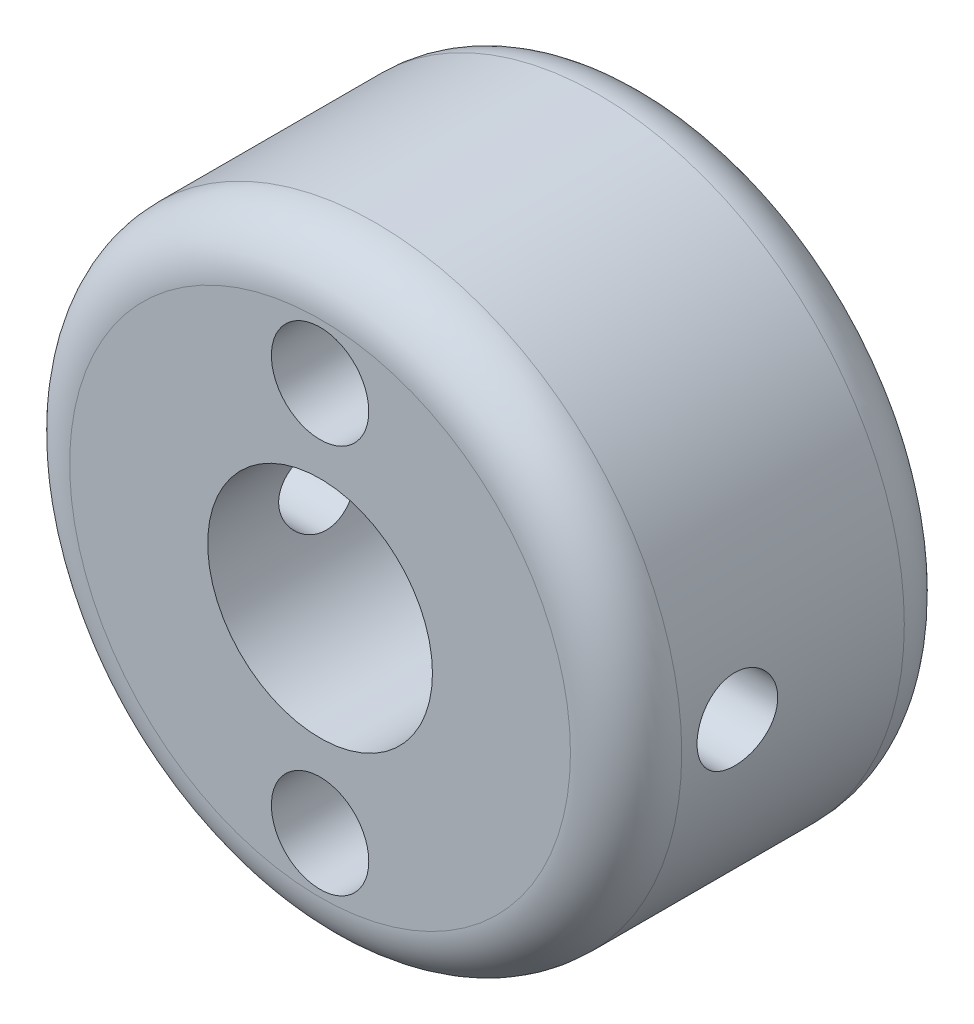
from build123d import *

# Parameters (mm, degrees)
SKETCH_1_R               = 11
EXTRUDE_1_DEPTH          = 12
SKETCH_3_R               = 1.75
CUT_EXTRUDE_1_DEPTH      = 20.646882704
SKETCH_4_R               = 4.04
CUT_EXTRUDE_2_DEPTH      = 10
CUT_EXTRUDE_3_DEPTH      = 20.646882704
CUT_EXTRUDE_3_DEPTH_BACK = 20.646882704
SKETCH_5_R               = 1.45
FILLET_1_R               = 2


with BuildPart() as part:
    # 草图1 → 凸台-拉伸1 (new body)
    with BuildSketch(Plane.XY):
        Circle(SKETCH_1_R)
    extrude(amount=EXTRUDE_1_DEPTH)

    # 草图3 → 切除-拉伸1 (cut, through all)
    with BuildSketch(Plane.XY.offset(12)):
        with Locations((0, 7)):
            Circle(SKETCH_3_R)
        with Locations((0, -7)):
            Circle(SKETCH_3_R)
    extrude(amount=-CUT_EXTRUDE_1_DEPTH, mode=Mode.SUBTRACT)

    # 草图4 → 切除-拉伸2 (cut)
    with BuildSketch(Plane.XY.offset(12)):
        Circle(SKETCH_4_R)
    extrude(amount=-CUT_EXTRUDE_2_DEPTH, mode=Mode.SUBTRACT)

    # 草图5 → 切除-拉伸3 (cut, two sides: drawn at the far end of the back side and taken through both)
    with BuildSketch(Plane(origin=(0, 0, 0), x_dir=(0, 0, -1), z_dir=(1, 0, 0)).offset(-CUT_EXTRUDE_3_DEPTH_BACK)):
        with Locations((-8, 0)):
            Circle(SKETCH_5_R)
    extrude(amount=CUT_EXTRUDE_3_DEPTH + CUT_EXTRUDE_3_DEPTH_BACK, mode=Mode.SUBTRACT)

    # 圆角1
    fillet_1_edges = [part.edges().sort_by_distance(p)[0] for p in [
        (-11, 0, 0),
        (-11, 0, 12),
    ]]
    fillet(fillet_1_edges, radius=FILLET_1_R)


solid = part.part
